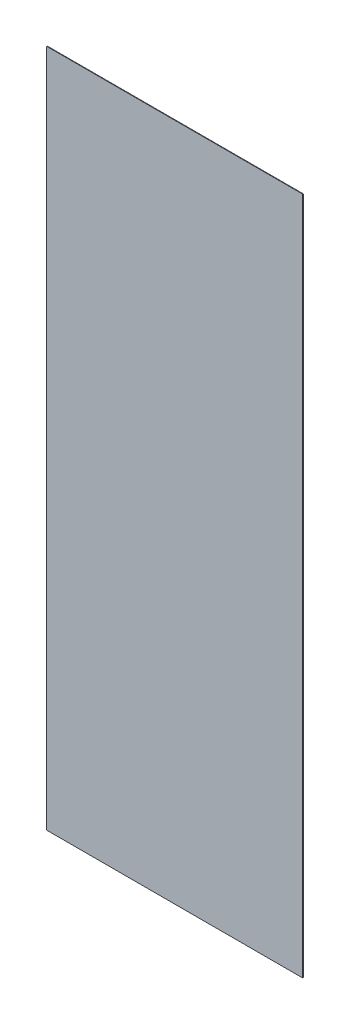
from build123d import *

# Parameters (mm, degrees)
OVEN_DIS_ARKA_1_START = -818.5
SKETCH1_W             = 697
SKETCH1_H             = 1848.5
OVEN_DIS_ARKA_1_DEPTH = 1.5


with BuildPart() as part:
    # Sketch1 → OVEN_dis_arka_1 (new body)
    with BuildSketch(Plane.XY.offset(OVEN_DIS_ARKA_1_START)):
        with Locations((350, 1044.25)):
            Rectangle(SKETCH1_W, SKETCH1_H)
    extrude(amount=-OVEN_DIS_ARKA_1_DEPTH)


solid = part.part
